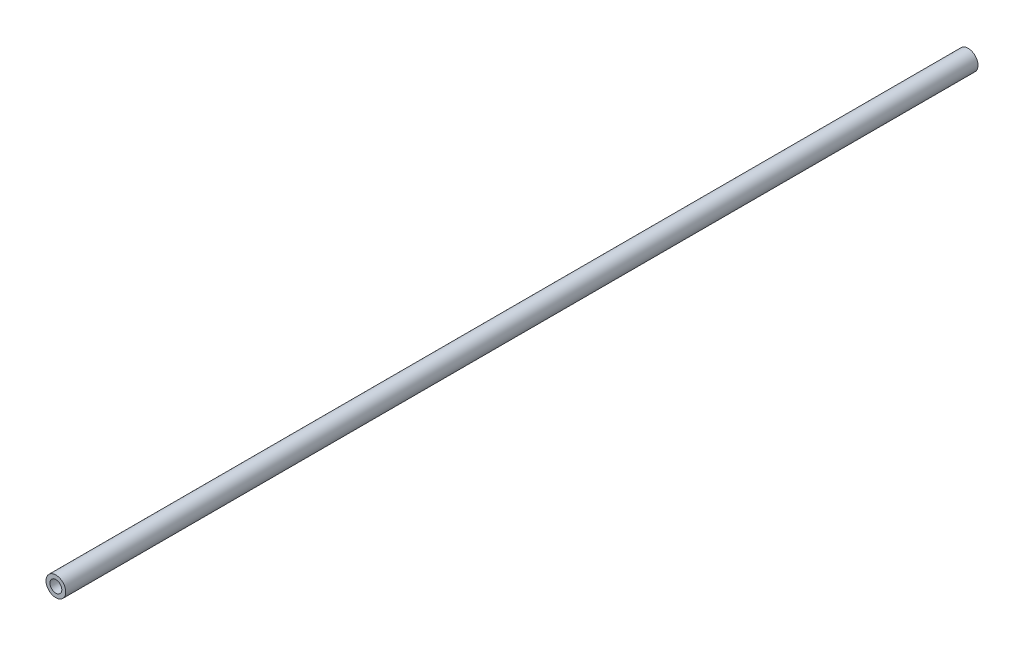
from build123d import *

# Parameters (mm, degrees)
SKETCH_1_R      = 5
SKETCH_1_R_2    = 3
EXTRUDE_1_DEPTH = 462.5


with BuildPart() as part:
    # 草图1 → 凸台-拉伸1 (new body)
    with BuildSketch(Plane.XY):
        with Locations(Location((0, 0, 0), (0, 0, 180))):
            Circle(SKETCH_1_R)
        with Locations(Location((0, 0, 0), (0, 0, 180))):
            Circle(SKETCH_1_R_2, mode=Mode.SUBTRACT)
    extrude(amount=EXTRUDE_1_DEPTH)


solid = part.part
